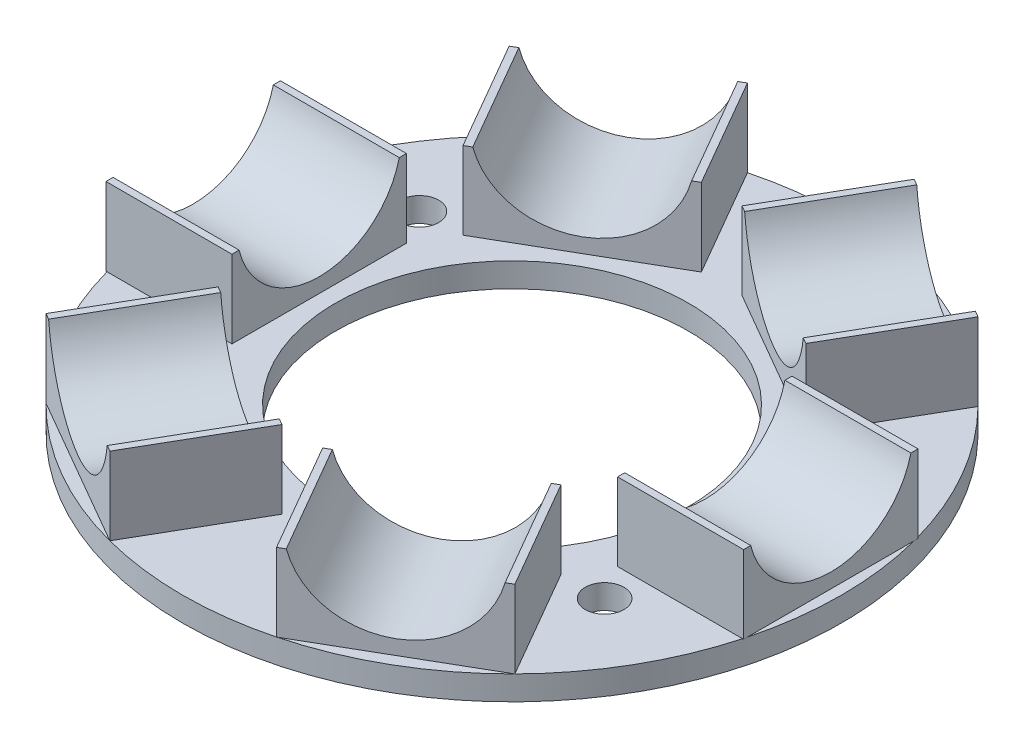
from build123d import *

# Parameters (mm, degrees)
SKETCH1_R           = 42.5
BOSS_EXTRUDE1_DEPTH = 2.5
SKETCH3_W           = 13
SKETCH3_H           = 18
BOSS_EXTRUDE2_DEPTH = 20
SKETCH4_R           = 8.5
CUT_EXTRUDE2_DEPTH  = 20
SKETCH5_R           = 8.5
CUT_EXTRUDE3_DEPTH  = 20
SKETCH6_R           = 8.5
CUT_EXTRUDE4_DEPTH  = 20
CUT_EXTRUDE5_START  = -20
SKETCH7_R           = 8.5
CUT_EXTRUDE5_DEPTH  = 20
CUT_EXTRUDE6_START  = -20
SKETCH8_R           = 8.5
CUT_EXTRUDE6_DEPTH  = 20
CUT_EXTRUDE7_START  = -20
SKETCH9_R           = 8.5
CUT_EXTRUDE7_DEPTH  = 20
CUT_EXTRUDE8_DEPTH  = 76.388
SKETCH11_W          = 71.811217628
SKETCH11_H          = 11.984599711
CUT_EXTRUDE9_DEPTH  = 76.388
SKETCH12_R          = 18.204170311
CUT_EXTRUDE10_DEPTH = 76.388
SKETCH13_R          = 1.997627935
CUT_EXTRUDE11_DEPTH = 10
CUT_EXTRUDE13_START = -24
SKETCH15_R          = 42.5
SKETCH15_R_2        = 34
CUT_EXTRUDE13_DEPTH = 24


with BuildPart() as part:
    # Sketch1 → Boss-Extrude1 (new body)
    with BuildSketch(Plane(origin=(0, 0, 0), x_dir=(1, 0, 0), z_dir=(0, 1, 0))):
        Circle(SKETCH1_R)
    extrude(amount=BOSS_EXTRUDE1_DEPTH)

    # Sketch3 → Boss-Extrude2 (add)
    with BuildSketch(Plane(origin=(0, 2.5, 0), x_dir=(1, 0, 0), z_dir=(0, 1, 0))):
        with Locations((-26.394376419, 0)):
            Rectangle(SKETCH3_W, SKETCH3_H)
        with Locations((26.394376419, 0)):
            Rectangle(SKETCH3_W, SKETCH3_H)
        Polygon((-8.599367677, 32.894541729), (-2.099367677, 21.63621148), (-17.687824945, 12.63621148), (-24.187824945, 23.894541729), align=None)
        Polygon((8.599367677, 32.894541729), (24.187824945, 23.894541729), (17.687824945, 12.63621148), (2.099367677, 21.63621148), align=None)
        Polygon((8.599367677, -32.894541729), (2.099367677, -21.63621148), (17.687824945, -12.63621148), (24.187824945, -23.894541729), align=None)
        Polygon((-8.599367677, -32.894541729), (-24.187824945, -23.894541729), (-17.687824945, -12.63621148), (-2.099367677, -21.63621148), align=None)
    extrude(amount=BOSS_EXTRUDE2_DEPTH)

    # Sketch4 → Cut-Extrude2 (cut)
    with BuildSketch(Plane.ZY.offset(32.894376419)):
        with Locations((0, 12.5)):
            Circle(SKETCH4_R)
    extrude(amount=-CUT_EXTRUDE2_DEPTH, mode=Mode.SUBTRACT)

    # Sketch5 → Cut-Extrude3 (cut)
    with BuildSketch(Plane(origin=(-16.393596311, 0, 28.394541729), x_dir=(0.8660254037844386, 0, 0.5000000000000003), z_dir=(-0.5000000000000003, 0, 0.8660254037844386))):
        with Locations((0, 12.5)):
            Circle(SKETCH5_R)
    extrude(amount=-CUT_EXTRUDE3_DEPTH, mode=Mode.SUBTRACT)

    # Sketch6 → Cut-Extrude4 (cut)
    with BuildSketch(Plane(origin=(16.393596311, 0, 28.394541729), x_dir=(0.8660254037844386, 0, -0.5000000000000003), z_dir=(0.5000000000000003, 0, 0.8660254037844386))):
        with Locations((0, 12.5)):
            Circle(SKETCH6_R)
    extrude(amount=-CUT_EXTRUDE4_DEPTH, mode=Mode.SUBTRACT)

    # Sketch7 → Cut-Extrude5 (cut)
    with BuildSketch(Plane(origin=(32.894376419, 0, 0), x_dir=(0, 0, -1), z_dir=(1, 0, 0)).offset(CUT_EXTRUDE5_START)):
        with Locations((0, 12.5)):
            Circle(SKETCH7_R)
    extrude(amount=CUT_EXTRUDE5_DEPTH, mode=Mode.SUBTRACT)

    # Sketch8 → Cut-Extrude6 (cut)
    with BuildSketch(Plane(origin=(16.393596311, 0, -28.394541729), x_dir=(-0.8660254037844386, 0, -0.5000000000000003), z_dir=(0.5000000000000003, 0, -0.8660254037844386)).offset(CUT_EXTRUDE6_START)):
        with Locations((0, 12.5)):
            Circle(SKETCH8_R)
    extrude(amount=CUT_EXTRUDE6_DEPTH, mode=Mode.SUBTRACT)

    # Sketch9 → Cut-Extrude7 (cut)
    with BuildSketch(Plane(origin=(-16.393596311, 0, -28.394541729), x_dir=(-0.8660254037844386, 0, 0.5000000000000003), z_dir=(-0.5000000000000003, 0, -0.8660254037844386)).offset(CUT_EXTRUDE7_START)):
        with Locations((0, 12.5)):
            Circle(SKETCH9_R)
    extrude(amount=CUT_EXTRUDE7_DEPTH, mode=Mode.SUBTRACT)

    # Sketch10 → Cut-Extrude8 (cut)
    with BuildSketch(Plane(origin=(-16.393596311, 0, -28.394541729), x_dir=(-0.8660254037844386, 0, 0.5000000000000003), z_dir=(-0.5000000000000003, 0, -0.8660254037844386))):
        Polygon((-35.669118209, 17.957805899), (-9, 17.957805899), (-9, 22.5), (9, 22.5), (9, 17.957805899), (33.747549551, 17.957805899), (33.747549551, 25.559573076), (-35.669118209, 25.559573076), align=None)
    extrude(amount=-CUT_EXTRUDE8_DEPTH, mode=Mode.SUBTRACT)

    # Sketch11 → Cut-Extrude9 (cut)
    with BuildSketch(Plane(origin=(-16.393596311, 0, -28.394541729), x_dir=(-0.8660254037844386, 0, 0.5000000000000003), z_dir=(-0.5000000000000003, 0, -0.8660254037844386))):
        with Locations((1.515702587, 16.507700144)):
            Rectangle(SKETCH11_W, SKETCH11_H)
    extrude(amount=-CUT_EXTRUDE9_DEPTH, mode=Mode.SUBTRACT)

    # Sketch12 → Cut-Extrude10 (cut)
    with BuildSketch(Plane(origin=(0, 2.5, 0), x_dir=(1, 0, 0), z_dir=(0, 1, 0))):
        Circle(SKETCH12_R)
    extrude(amount=-CUT_EXTRUDE10_DEPTH, mode=Mode.SUBTRACT)

    # Sketch13 → Cut-Extrude11 (cut)
    with BuildSketch(Plane(origin=(0, 2.5, 0), x_dir=(1, 0, 0), z_dir=(0, 1, 0))):
        with Locations((-22.072556502, 12.515367089)):
            Circle(SKETCH13_R)
        with Locations((22.072556502, 12.515367089)):
            Circle(SKETCH13_R)
        with Locations((22.072556502, -12.515367089)):
            Circle(SKETCH13_R)
        with Locations((-22.072556502, -12.515367089)):
            Circle(SKETCH13_R)
    extrude(amount=-CUT_EXTRUDE11_DEPTH, mode=Mode.SUBTRACT)

    # Sketch15 → Cut-Extrude13 (cut)
    with BuildSketch(Plane(origin=(0, 2.5, 0), x_dir=(1, 0, 0), z_dir=(0, 1, 0)).offset(CUT_EXTRUDE13_START)):
        Circle(SKETCH15_R)
        Circle(SKETCH15_R_2, mode=Mode.SUBTRACT)
    extrude(amount=CUT_EXTRUDE13_DEPTH, mode=Mode.SUBTRACT)


solid = part.part
